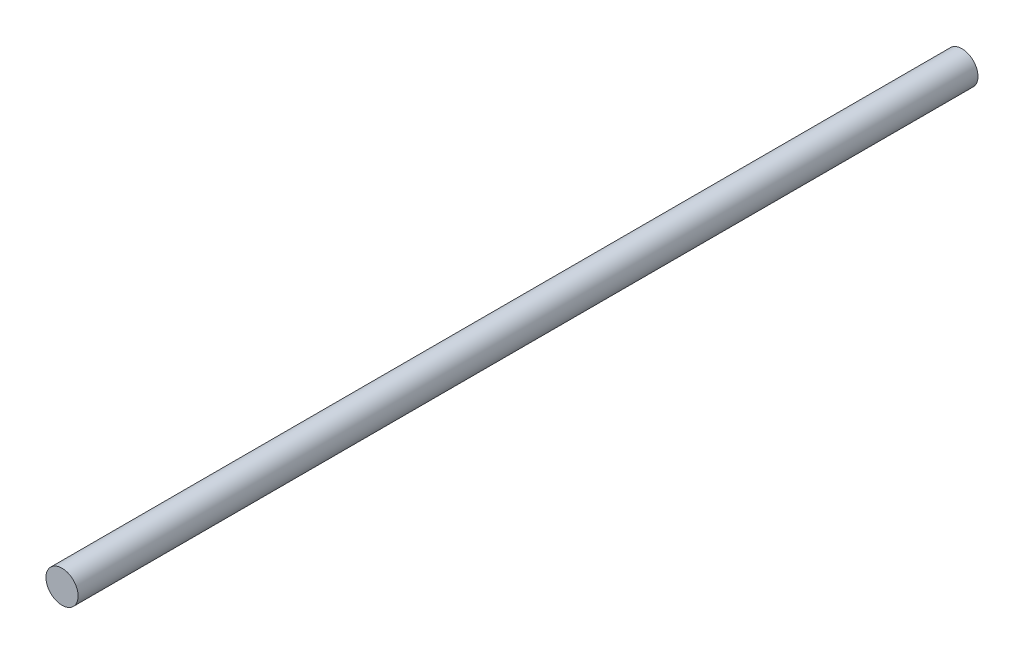
from build123d import *

# Parameters (mm, degrees)
SKETCH1_R           = 1.5
BOSS_EXTRUDE1_DEPTH = 100
CUT_EXTRUDE1_START  = -16
SKETCH2_R           = 1.5
CUT_EXTRUDE1_DEPTH  = 16


with BuildPart() as part:
    # Sketch1 → Boss-Extrude1 (new body)
    with BuildSketch(Plane.XY):
        Circle(SKETCH1_R)
    extrude(amount=BOSS_EXTRUDE1_DEPTH)

    # Sketch2 → Cut-Extrude1 (cut)
    with BuildSketch(Plane.XY.offset(100).offset(CUT_EXTRUDE1_START)):
        Circle(SKETCH2_R)
    extrude(amount=CUT_EXTRUDE1_DEPTH, mode=Mode.SUBTRACT)


solid = part.part
